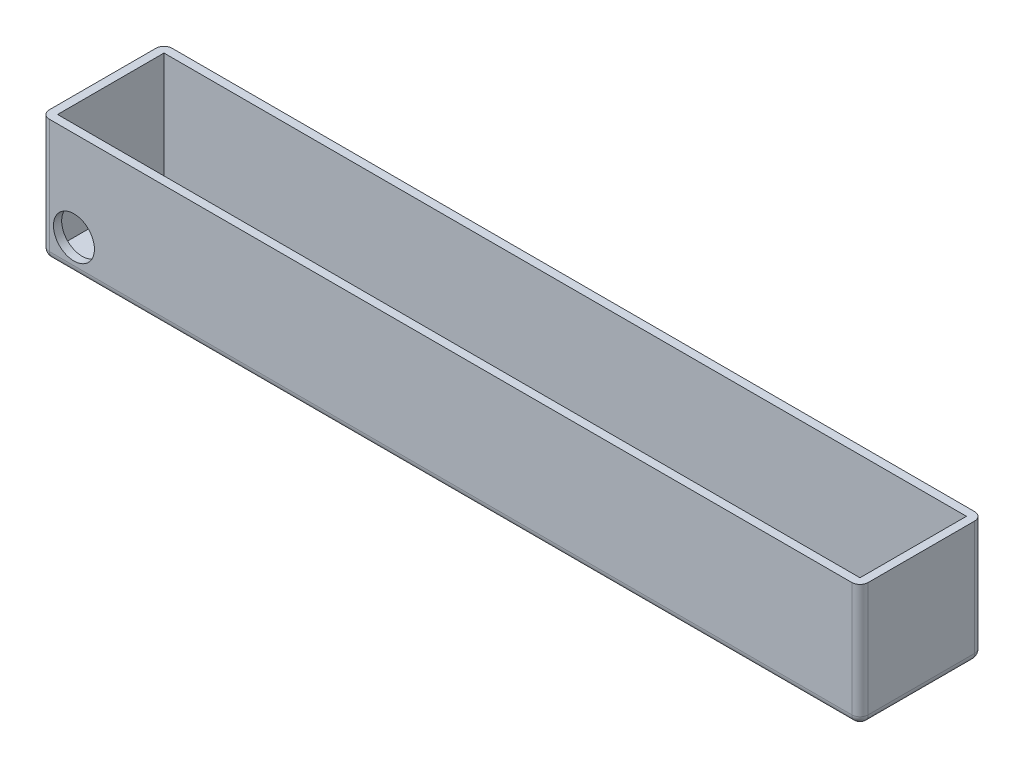
from build123d import *

# Parameters (mm, degrees)
BOSS_EXTRUDE1_DEPTH = 124.46
BOSS_EXTRUDE2_START = 127
BOSS_EXTRUDE2_DEPTH = 2.54
BOSS_EXTRUDE3_START = -124.46
BOSS_EXTRUDE3_DEPTH = 2.54
CUT_EXTRUDE1_START  = 19.05
SKETCH4_R           = 6.35
CUT_EXTRUDE1_DEPTH  = 2.54
FILLET1_R           = 2.54
FILLET2_R           = 2.54


with BuildPart() as part:
    # Sketch1 → Boss-Extrude1 (new, symmetric)
    with BuildSketch(Plane(origin=(0, 0, 0), x_dir=(0, 0, -1), z_dir=(1, 0, 0))):
        with BuildLine():
            Line((-16.51, 38.1), (-19.05, 38.1))
            Line((-19.05, 38.1), (-19.05, 2.54))
            ThreePointArc((-19.05, 2.54), (-18.306051224, 0.743948776), (-16.51, 0))
            Line((-16.51, 0), (0, 0))
            Line((0, 0), (0, 1.016))
            Line((0, 1.016), (-6.35, 1.016))
            Line((-6.35, 1.016), (-6.35, 2.54))
            Line((-6.35, 2.54), (-16.51, 2.54))
            Line((-16.51, 2.54), (-16.51, 38.1))
        make_face()
        with BuildLine():
            Line((0, 1.016), (0, 0))
            Line((0, 0), (16.51, 0))
            ThreePointArc((16.51, 0), (18.306051224, 0.743948776), (19.05, 2.54))
            Line((19.05, 2.54), (19.05, 38.1))
            Line((19.05, 38.1), (16.51, 38.1))
            Line((16.51, 38.1), (16.51, 2.54))
            Line((16.51, 2.54), (6.35, 2.54))
            Line((6.35, 2.54), (6.35, 1.016))
            Line((6.35, 1.016), (0, 1.016))
        make_face()
    extrude(amount=BOSS_EXTRUDE1_DEPTH, both=True)

    # Sketch3 → Boss-Extrude2 (add)
    with BuildSketch(Plane(origin=(0, 0, 0), x_dir=(0, 0, -1), z_dir=(1, 0, 0)).offset(BOSS_EXTRUDE2_START)):
        with BuildLine():
            Line((0, 38.1), (-19.05, 38.1))
            Line((-19.05, 38.1), (-19.05, 2.54))
            ThreePointArc((-19.05, 2.54), (-18.306051224, 0.743948776), (-16.51, 0))
            Line((-16.51, 0), (0, 0))
            Line((0, 0), (0, 38.1))
        make_face()
        with BuildLine():
            Line((19.05, 38.1), (0, 38.1))
            Line((0, 38.1), (0, 0))
            Line((0, 0), (16.51, 0))
            ThreePointArc((16.51, 0), (18.306051224, 0.743948776), (19.05, 2.54))
            Line((19.05, 2.54), (19.05, 38.1))
        make_face()
    extrude(amount=-BOSS_EXTRUDE2_DEPTH)

    # Sketch3<4> → Boss-Extrude3 (add)
    with BuildSketch(Plane(origin=(0, 0, 0), x_dir=(0, 0, -1), z_dir=(1, 0, 0)).offset(BOSS_EXTRUDE3_START)):
        with BuildLine():
            Line((0, 38.1), (-19.05, 38.1))
            Line((-19.05, 38.1), (-19.05, 2.54))
            ThreePointArc((-19.05, 2.54), (-18.306051224, 0.743948776), (-16.51, 0))
            Line((-16.51, 0), (0, 0))
            Line((0, 0), (0, 38.1))
        make_face()
        with BuildLine():
            Line((19.05, 38.1), (0, 38.1))
            Line((0, 38.1), (0, 0))
            Line((0, 0), (16.51, 0))
            ThreePointArc((16.51, 0), (18.306051224, 0.743948776), (19.05, 2.54))
            Line((19.05, 2.54), (19.05, 38.1))
        make_face()
    extrude(amount=-BOSS_EXTRUDE3_DEPTH)

    # Sketch4 → Cut-Extrude1 (cut)
    with BuildSketch(Plane.XY.offset(CUT_EXTRUDE1_START)):
        with Locations((-116.84, 10.16)):
            Circle(SKETCH4_R)
    extrude(amount=-CUT_EXTRUDE1_DEPTH, mode=Mode.SUBTRACT)

    # Fillet1
    fillet1_edges = [part.edges().sort_by_distance(p)[0] for p in [
        (-127, 0.743948776, -18.306051224),
        (-127, 0, 0),
        (-127, 0.743948776, 18.306051224),
        (-127, 20.32, 19.05),
        (-127, 20.32, -19.05),
    ]]
    fillet(fillet1_edges, radius=FILLET1_R)

    # Fillet2
    fillet2_edges = [part.edges().sort_by_distance(p)[0] for p in [
        (127, 0, 0),
        (127, 20.32, 19.05),
        (127, 0.743948776, -18.306051224),
        (127, 20.32, -19.05),
        (127, 0.743948776, 18.306051224),
    ]]
    fillet(fillet2_edges, radius=FILLET2_R)


solid = part.part
